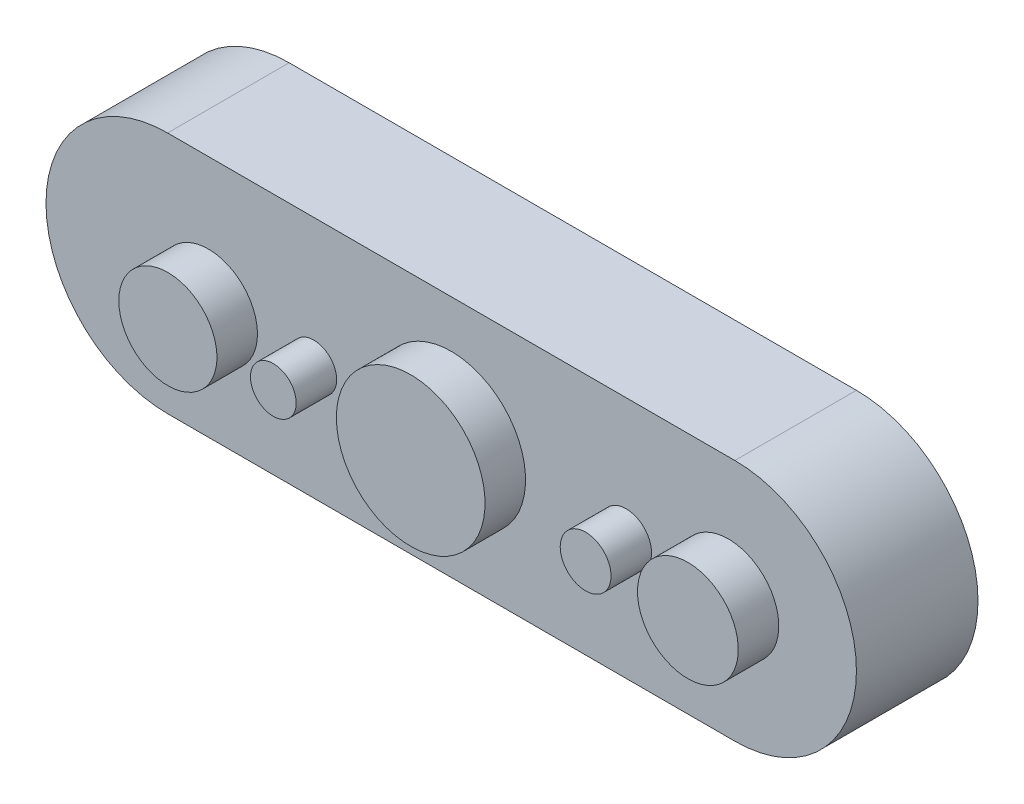
from build123d import *

# Parameters (mm, degrees)
BOSS_EXTRUDE1_DEPTH = 1.5
SKETCH2_W           = 0.621894726
SKETCH2_H           = 0.5
SKETCH3_W           = 0.313581939
SKETCH3_H           = 0.5
SKETCH4_W           = 0.917270519
SKETCH4_H           = 0.5
SKETCH5_W           = 0.282237083
SKETCH5_H           = 0.5
SKETCH6_W           = 0.605170604
SKETCH6_H           = 0.5


with BuildPart() as part:
    # Sketch1 → Boss-Extrude1 (new body)
    with BuildSketch(Plane(origin=(0, 0, 0), x_dir=(-1, 0, 0), z_dir=(0, 0, -1))):
        with BuildLine():
            Line((3.5, 1.5), (-3.5, 1.5))
            ThreePointArc((-3.5, 1.5), (-5, 0), (-3.5, -1.5))
            Line((-3.5, -1.5), (3.5, -1.5))
            ThreePointArc((3.5, -1.5), (5, 0), (3.5, 1.5))
        make_face()
    extrude(amount=-BOSS_EXTRUDE1_DEPTH)

    # Sketch2 → Revolve1 (revolve)
    with BuildSketch(Plane.XZ, mode=Mode.PRIVATE) as revolve1_sk:
        with Locations((3.731030185, 1.75)):
            Rectangle(SKETCH2_W, SKETCH2_H)
    revolve(revolve1_sk.sketch.rotate(Axis((3.420082822, 0, 2), (0, 0, -1)), 180), axis=Axis((3.420082822, 0, 2), (0, 0, -1)))

    # Sketch3 → Revolve2 (revolve)
    with BuildSketch(Plane.XZ, mode=Mode.PRIVATE) as revolve2_sk:
        with Locations((2.315287044, 1.75)):
            Rectangle(SKETCH3_W, SKETCH3_H)
    revolve(revolve2_sk.sketch.rotate(Axis((2.158496075, 0, 2), (0, 0, -1)), 180), axis=Axis((2.158496075, 0, 2), (0, 0, -1)))

    # Sketch4 → Revolve3 (revolve)
    with BuildSketch(Plane.XZ, mode=Mode.PRIVATE) as revolve3_sk:
        with Locations((0.45863526, 1.75)):
            Rectangle(SKETCH4_W, SKETCH4_H)
    revolve(revolve3_sk.sketch.rotate(Axis((0, 0, 2), (0, 0, -1)), 180), axis=Axis((0, 0, 2), (0, 0, -1)))

    # Sketch5 → Revolve4 (revolve)
    with BuildSketch(Plane.XZ.offset(0.093633391), mode=Mode.PRIVATE) as revolve4_sk:
        with Locations((-1.554138651, 1.75)):
            Rectangle(SKETCH5_W, SKETCH5_H)
    revolve(revolve4_sk.sketch.rotate(Axis((-1.695257192, -0.093633391, 2), (0, 0, -1)), 180), axis=Axis((-1.695257192, -0.093633391, 2), (0, 0, -1)))

    # Sketch6 → Revolve5 (revolve)
    with BuildSketch(Plane.XZ.offset(0.093633391), mode=Mode.PRIVATE) as revolve5_sk:
        with Locations((-2.693683223, 1.75)):
            Rectangle(SKETCH6_W, SKETCH6_H)
    revolve(revolve5_sk.sketch.rotate(Axis((-2.996268525, -0.093633391, 2), (0, 0, -1)), 180), axis=Axis((-2.996268525, -0.093633391, 2), (0, 0, -1)))


solid = part.part
